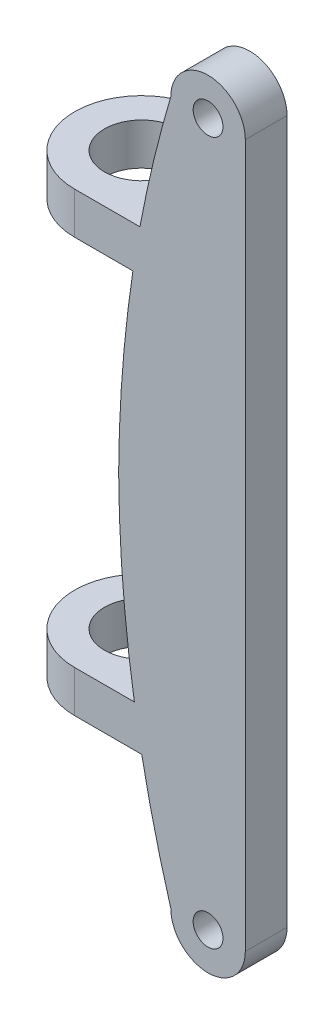
from build123d import *

# Parameters (mm, degrees)
CROQUIS3_R              = 1
SALIENTE_EXTRUIR1_DEPTH = 2.8
SALIENTE_EXTRUIR2_START = 12.5
CROQUIS4_R              = 2.5
SALIENTE_EXTRUIR2_DEPTH = 2.8
SALIENTE_EXTRUIR3_START = -15.3
CROQUIS4_2_R            = 2.5
SALIENTE_EXTRUIR3_DEPTH = 2.8


with BuildPart() as part:
    # Croquis3 → Saliente-Extruir1 (new body)
    with BuildSketch(Plane.XY):
        with BuildLine():
            Line((4.846627727, 23.897818016), (4.846627727, -23.274751548))
            ThreePointArc((4.846627727, -23.274751548), (2.346627727, -25.774751548), (-0.153372273, -23.274751548))
            ThreePointArc((-0.153372273, -23.274751548), (-2.736363907, -11.605217887), (-3.653372273, 0.311533234))
            ThreePointArc((-3.653372273, 0.311533234), (-2.736363907, 12.228284355), (-0.153372273, 23.897818016))
            ThreePointArc((-0.153372273, 23.897818016), (2.346627727, 26.397818016), (4.846627727, 23.897818016))
        make_face()
        with Locations((2.346627727, 23.897818016)):
            Circle(CROQUIS3_R, mode=Mode.SUBTRACT)
        with Locations((2.346627727, -23.274751548)):
            Circle(CROQUIS3_R, mode=Mode.SUBTRACT)
    extrude(amount=SALIENTE_EXTRUIR1_DEPTH)

    # Croquis4 → Saliente-Extruir2 (add)
    with BuildSketch(Plane(origin=(0, 0, 0), x_dir=(1, 0, 0), z_dir=(0, 1, 0)).offset(SALIENTE_EXTRUIR2_START)):
        with BuildLine():
            Line((4.846627727, 0), (-4.267297244, 5.544479263))
            ThreePointArc((-4.267297244, 5.544479263), (-10.939117757, 2.914463527), (-6.606095909, -2.8))
            Line((-6.606095909, -2.8), (-3.653372273, -2.8))
            Line((-3.653372273, -2.8), (4.846627727, -2.8))
            Line((4.846627727, -2.8), (4.846627727, 0))
        make_face()
        with Locations((-6.606095909, 1.7)):
            Circle(CROQUIS4_R, mode=Mode.SUBTRACT)
    extrude(amount=SALIENTE_EXTRUIR2_DEPTH)

    # Croquis4<2> → Saliente-Extruir3 (add)
    with BuildSketch(Plane(origin=(0, 0, 0), x_dir=(1, 0, 0), z_dir=(0, 1, 0)).offset(SALIENTE_EXTRUIR3_START)):
        with BuildLine():
            Line((4.846627727, 0), (-4.267297244, 5.544479263))
            ThreePointArc((-4.267297244, 5.544479263), (-10.939117757, 2.914463527), (-6.606095909, -2.8))
            Line((-6.606095909, -2.8), (-3.653372273, -2.8))
            Line((-3.653372273, -2.8), (4.846627727, -2.8))
            Line((4.846627727, -2.8), (4.846627727, 0))
        make_face()
        with Locations((-6.606095909, 1.7)):
            Circle(CROQUIS4_2_R, mode=Mode.SUBTRACT)
    extrude(amount=SALIENTE_EXTRUIR3_DEPTH)


solid = part.part
